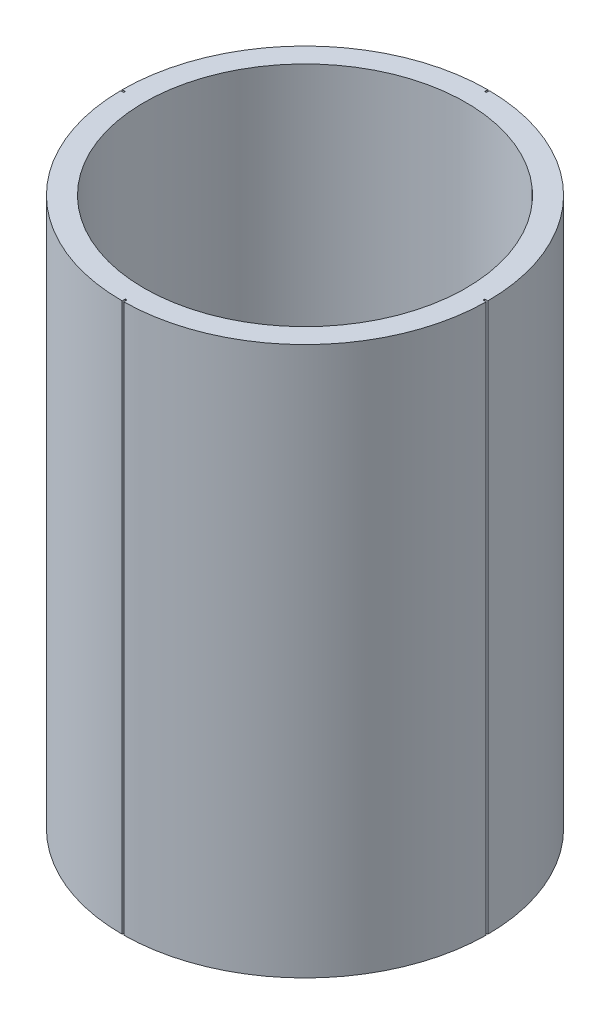
from build123d import *

# Parameters (mm, degrees)
SKETCH1_R           = 4.4
BOSS_EXTRUDE1_DEPTH = 15


with BuildPart() as part:
    # Sketch1 → Boss-Extrude1 (new body)
    with BuildSketch(Plane(origin=(0, 0, 0), x_dir=(1, 0, 0), z_dir=(0, 1, 0))):
        with BuildLine():
            Line((0, 5), (0, 4.912292599))
            Line((0, 4.912292599), (0.042868928, 4.912292599))
            Line((0.042868928, 4.912292599), (0.043632677, 4.999809615))
            ThreePointArc((0.043632677, 4.999809615), (3.550926878, 3.520073622), (5, 0))
            Line((5, 0), (4.915051898, 0))
            Line((4.915051898, 0), (4.915051898, -0.042893008))
            Line((4.915051898, -0.042893008), (4.999809615, -0.043632677))
            ThreePointArc((4.999809615, -0.043632677), (3.535533906, -3.535533906), (0.043632677, -4.999809615))
            Line((0.043632677, -4.999809615), (0.042868928, -4.912292599))
            Line((0.042868928, -4.912292599), (0, -4.912292599))
            Line((0, -4.912292599), (0, -5))
            ThreePointArc((0, -5), (-3.520073622, -3.550926878), (-4.999809615, -0.043632677))
            Line((-4.999809615, -0.043632677), (-4.915051898, -0.042893008))
            Line((-4.915051898, -0.042893008), (-4.915051898, 0))
            Line((-4.915051898, 0), (-5, 0))
            ThreePointArc((-5, 0), (-3.535533906, 3.535533906), (0, 5))
        make_face()
        with Locations(Location((0, 0, 0), (0, 0, 270))):
            Circle(SKETCH1_R, mode=Mode.SUBTRACT)
    extrude(amount=BOSS_EXTRUDE1_DEPTH)


solid = part.part
